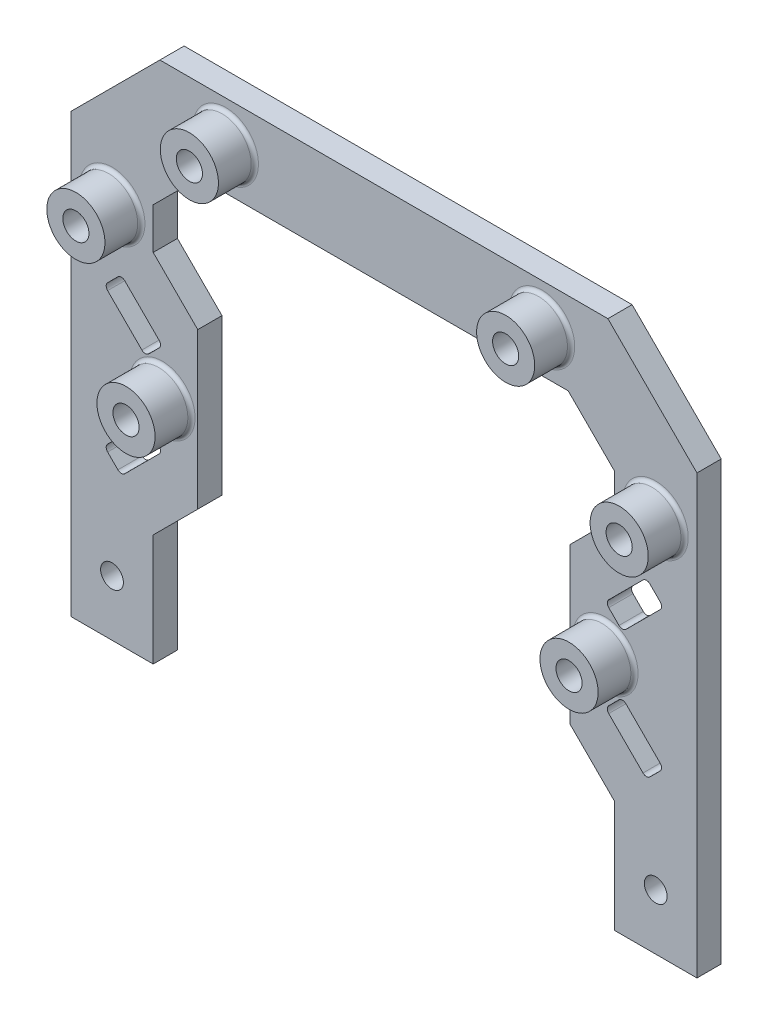
from build123d import *

# Parameters (mm, degrees)
BOSS_EXTRUDE2_DEPTH = 5
SKETCH4_R           = 6
BOSS_EXTRUDE3_DEPTH = 7.5
FILLET1_R           = 0.75
SKETCH5_R           = 2.35
CUT_EXTRUDE1_DEPTH  = 5
SKETCH6_R           = 2.7
CUT_EXTRUDE2_DEPTH  = 12.5
CUT_EXTRUDE3_DEPTH  = 5
FILLET2_R           = 1


with BuildPart() as part:
    # Sketch2 → Boss-Extrude2 (new body)
    with BuildSketch(Plane.XY):
        Polygon((-38.034853609, 91.624315191), (0, 91.624315191), (38.034853609, 91.624315191), (47.595357442, 82.063811359), (47.595357442, 73.548798616), (38.402969286, 64.356410461), (38.402969286, 32.26790473), (47.595357442, 23.075516575), (47.595357442, 0), (64.595357442, 0), (64.595357442, 90.244528717), (46.215570967, 108.624315191), (0, 108.624315191), (-46.215570967, 108.624315191), (-64.595357442, 90.244528717), (-64.595357442, 0), (-47.595357442, 0), (-47.595357442, 23.075516575), (-38.402969286, 32.26790473), (-38.402969286, 64.356410461), (-47.595357442, 73.548798616), (-47.595357442, 82.063811359), align=None)
    extrude(amount=-BOSS_EXTRUDE2_DEPTH)

    # Sketch4 → Boss-Extrude3 (add)
    with BuildSketch(Plane.XY):
        with Locations(Location((45.702969286, 48.312157595, 0), (0, 0, 180))):
            Circle(SKETCH4_R)
        with Locations(Location((56.046263063, 77.806304987, 0), (0, 0, 180))):
            Circle(SKETCH4_R)
        with Locations(Location((32.627642792, 100.189552245, 0), (0, 0, 180))):
            Circle(SKETCH4_R)
        with Locations(Location((-32.627642792, 100.189552245, 0), (0, 0, 180))):
            Circle(SKETCH4_R)
        with Locations(Location((-45.702969286, 48.312157595, 0), (0, 0, 180))):
            Circle(SKETCH4_R)
        with Locations(Location((-56.046263063, 77.806304987, 0), (0, 0, 180))):
            Circle(SKETCH4_R)
    extrude(amount=BOSS_EXTRUDE3_DEPTH)

    # Fillet1
    fillet1_edges = [part.edges().sort_by_distance(p)[0] for p in [
        (51.702969286, 48.312157595, 0),
        (-50.046263063, 77.806304987, 0),
        (-39.702969286, 48.312157595, 0),
        (-26.627642792, 100.189552245, 0),
        (38.627642792, 100.189552245, 0),
        (62.046263063, 77.806304987, 0),
    ]]
    fillet(fillet1_edges, radius=FILLET1_R)

    # Sketch5 → Cut-Extrude1 (cut)
    with BuildSketch(Plane(origin=(0, 0, -5), x_dir=(-1, 0, 0), z_dir=(0, 0, -1))):
        with Locations((56.095357442, 11.5)):
            Circle(SKETCH5_R)
        with Locations((-56.095357442, 11.5)):
            Circle(SKETCH5_R)
    extrude(amount=-CUT_EXTRUDE1_DEPTH, mode=Mode.SUBTRACT)

    # Sketch6 → Cut-Extrude2 (cut)
    with BuildSketch(Plane.XY.offset(7.5)):
        with Locations((-45.702969286, 48.312157595)):
            Circle(SKETCH6_R)
        with Locations((-32.627642792, 100.189552245)):
            Circle(SKETCH6_R)
        with Locations((32.627642792, 100.189552245)):
            Circle(SKETCH6_R)
        with Locations((56.046263063, 77.806304987)):
            Circle(SKETCH6_R)
        with Locations((45.702969286, 48.312157595)):
            Circle(SKETCH6_R)
        with Locations((-56.046263063, 77.806304987)):
            Circle(SKETCH6_R)
    extrude(amount=-CUT_EXTRUDE2_DEPTH, mode=Mode.SUBTRACT)

    # Sketch7 → Cut-Extrude3 (cut)
    with BuildSketch(Plane(origin=(0, 0, -5), x_dir=(-1, 0, 0), z_dir=(0, 0, -1))):
        Polygon((45.686169132, 57.780317396), (49.221703038, 54.24478349), (57.706984413, 62.730064864), (54.171450507, 66.26559877), align=None)
        Polygon((54.171450507, 30.358716421), (57.706984413, 33.894250327), (49.221703038, 42.379531701), (45.686169132, 38.843997795), align=None)
        Polygon((-54.171450507, 66.26559877), (-57.706984413, 62.730064864), (-49.221703038, 54.24478349), (-45.686169132, 57.780317396), align=None)
        Polygon((-45.686169132, 38.843997795), (-49.221703038, 42.379531701), (-57.706984413, 33.894250327), (-54.171450507, 30.358716421), align=None)
    extrude(amount=-CUT_EXTRUDE3_DEPTH, mode=Mode.SUBTRACT)

    # Fillet2
    fillet2_edges = [part.edges().sort_by_distance(p)[0] for p in [
        (-54.171450507, 30.358716421, -2.5),
        (-45.686169132, 38.843997795, -2.5),
        (-49.221703038, 42.379531701, -2.5),
        (-57.706984413, 33.894250327, -2.5),
        (54.171450507, 66.26559877, -2.5),
        (45.686169132, 57.780317396, -2.5),
        (49.221703038, 54.24478349, -2.5),
        (57.706984413, 62.730064864, -2.5),
        (45.686169132, 38.843997795, -2.5),
        (54.171450507, 30.358716421, -2.5),
        (57.706984413, 33.894250327, -2.5),
        (49.221703038, 42.379531701, -2.5),
        (-45.686169132, 57.780317396, -2.5),
        (-54.171450507, 66.26559877, -2.5),
        (-57.706984413, 62.730064864, -2.5),
        (-49.221703038, 54.24478349, -2.5),
    ]]
    fillet(fillet2_edges, radius=FILLET2_R)


solid = part.part
